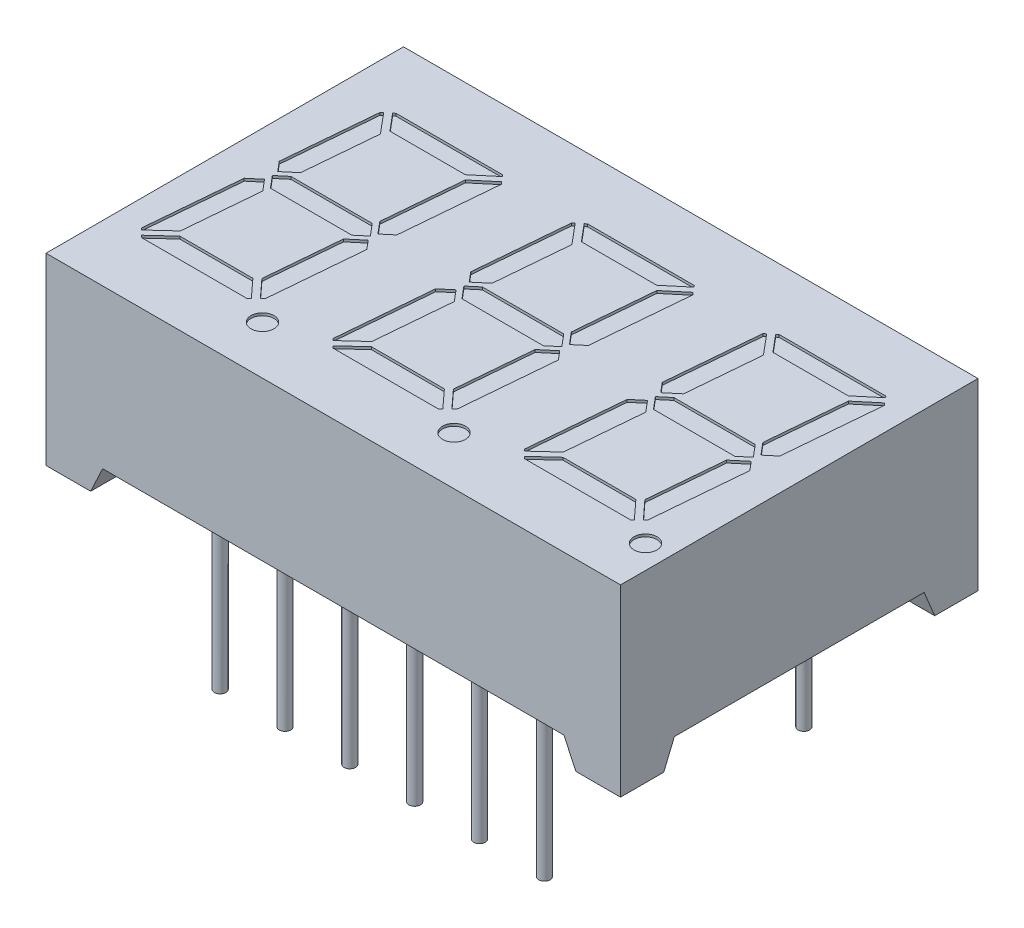
from build123d import *

# Parameters (mm, degrees)
SKETCH1_W                       = 22.5
SKETCH1_H                       = 14
EXTRUDE1_DEPTH                  = 7.2
SKETCH6_R                       = 0.45
CUT_EXTRUDE1_DEPTH              = 0.1
CUT_EXTRUDE2_DEPTH              = 25.639196415
CUT_EXTRUDE2_DEPTH_BACK         = 25.639196415
CUT_EXTRUDE3_DEPTH              = 20.349483197
CUT_EXTRUDE3_DEPTH_BACK         = 20.349483197
LPATTERN1_COUNT                 = 2
LPATTERN1_PITCH                 = 7.5
LPATTERN2_COUNT                 = 2
LPATTERN2_PITCH                 = 7.5
SKETCH11_R                      = 0.225
BOSS_EXTRUDE4_DEPTH             = 6.1
BOSS_EXTRUDE4_DIRECTION_2_REACH = 17.08
LPATTERN3_COUNT                 = 6
LPATTERN3_PITCH                 = 2.54
LPATTERN3_COUNT_DIR2            = 2
LPATTERN3_PITCH_DIR2            = 10.16


with BuildPart() as part:
    # Sketch1 → Extrude1 (new body)
    with BuildSketch(Plane(origin=(0, 0, 0), x_dir=(1, 0, 0), z_dir=(0, 1, 0))):
        Rectangle(SKETCH1_W, SKETCH1_H)
    extrude(amount=-EXTRUDE1_DEPTH)

    # Sketch6 → Cut-Extrude1 (cut)
    with BuildSketch(Plane(origin=(0, 0, 0), x_dir=(-1, 0, 0), z_dir=(0, 1, 0))):
        with Locations(Location((-2.828914589, 5.1, 0), (0, 0, 90))):
            Circle(SKETCH6_R)
        Polygon((1.615140342, 0.645647316), (1.874984591, 3.615680666), (2.672057265, 4.346063205), (2.736318521, 4.281801948), (2.412096101, 0.575922722), (1.978755924, 0.212307139), align=None)
        Polygon((-2.08510989, 4.246446609), (-2.404999919, 0.590086851), (-2.118563171, 0.248724827), (-1.593244842, 0.689519243), (-1.335889658, 3.631102448), (-1.988382771, 4.343173729), align=None)
        Polygon((-2.751982586, -4.346963991), (-2.828914589, -4.255280001), (-2.499336567, -0.488185972), (-2.097293847, -0.150832074), (-1.707416581, -0.615469707), (-1.976986224, -3.696664829), align=None)
        Polygon((-2.591285684, -4.538475102), (-1.79792785, -3.872768836), (1.154576659, -3.872768836), (1.713170541, -4.538475102), (1.639848023, -4.6), (-2.539660165, -4.6), align=None)
        Polygon((1.560181456, -0.4), (1.954104558, -0.069459271), (1.560181456, 0.4), (-1.627135675, 0.4), (-2.021058776, 0.069459271), (-1.627135675, -0.4), align=None)
        Polygon((2.495112157, 4.523008313), (2.41812047, 4.6), (-1.7315565, 4.6), (-1.811437663, 4.520118836), (-1.151570324, 3.8), (1.706087039, 3.8), align=None)
        Polygon((1.982853172, -0.306417777), (2.30166085, -0.686357973), (1.984568022, -4.310745576), (1.904681652, -4.377778199), (1.244483112, -3.590984217), (1.496113015, -0.714841264), align=None)
    cut_extrude1 = extrude(amount=-CUT_EXTRUDE1_DEPTH, mode=Mode.SUBTRACT)

    # Sketch12 → Cut-Extrude2 (cut, two sides: drawn at the far end of the back side and taken through both)
    with BuildSketch(Plane.ZY.offset(11.25).offset(-CUT_EXTRUDE2_DEPTH_BACK)):
        Polygon((-20.043427491, -42.781711537), (-5.305, -7.2), (-4.890786438, -6.2), (4.890786438, -6.2), (5.305, -7.2), (20.043427491, -42.781711537), (20.043427491, -119.808445619), (-20.043427491, -119.808445619), align=None)
    extrude(amount=CUT_EXTRUDE2_DEPTH + CUT_EXTRUDE2_DEPTH_BACK, mode=Mode.SUBTRACT)

    # Sketch13 → Cut-Extrude3 (cut, two sides: drawn at the far end of the back side and taken through both)
    with BuildSketch(Plane(origin=(0, 0, -7), x_dir=(-1, 0, 0), z_dir=(0, 0, -1)).offset(-CUT_EXTRUDE3_DEPTH_BACK)):
        Polygon((-32.290672921, -56.074755802), (-9.5, -7.2), (-9.033692342, -6.2), (9.033692342, -6.2), (9.5, -7.2), (32.290672921, -56.074755802), (32.290672921, -163.929408496), (-32.290672921, -163.929408496), align=None)
    extrude(amount=CUT_EXTRUDE3_DEPTH + CUT_EXTRUDE3_DEPTH_BACK, mode=Mode.SUBTRACT)

    # LPattern1: Cut-Extrude1 ×2
    with Locations(*[(i * LPATTERN1_PITCH, 0, 0) for i in range(1, LPATTERN1_COUNT)]):
        add(cut_extrude1, mode=Mode.SUBTRACT)

    # LPattern2: Cut-Extrude1 ×2
    with Locations(*[(-i * LPATTERN2_PITCH, 0, 0) for i in range(1, LPATTERN2_COUNT)]):
        add(cut_extrude1, mode=Mode.SUBTRACT)

    # Sketch11 → Boss-Extrude4 (add)
    with BuildSketch(Plane.XZ.offset(7.2)):
        with Locations(Location((6.35, 5.08, 0), (0, 0, 270))):
            Circle(SKETCH11_R)
    boss_extrude4 = extrude(amount=BOSS_EXTRUDE4_DEPTH)

    # Sketch11 → Boss-Extrude4 direction 2 (add, up to next)
    with BuildSketch(Plane.XZ.offset(7.2), mode=Mode.PRIVATE) as boss_extrude4_direction_2_sk1:
        with Locations(Location((6.35, 5.08, 0), (0, 0, 270))):
            Circle(SKETCH11_R)
    boss_extrude4_direction_2_tool1 = extrude(boss_extrude4_direction_2_sk1.sketch, amount=-BOSS_EXTRUDE4_DIRECTION_2_REACH, mode=Mode.PRIVATE) - part.part
    boss_extrude4_direction_2 = boss_extrude4_direction_2_tool1.solids().sort_by_distance((6.35, -7.2, 5.08))[0]
    add(boss_extrude4_direction_2)

    # LPattern3: Boss-Extrude4, Boss-Extrude4 direction 2 6 × 2
    with Locations(*[(-i * LPATTERN3_PITCH, 0, -j * LPATTERN3_PITCH_DIR2) for i in range(LPATTERN3_COUNT) for j in range(LPATTERN3_COUNT_DIR2) if (i, j) != (0, 0)]):
        add(boss_extrude4)
        add(boss_extrude4_direction_2)


solid = part.part
